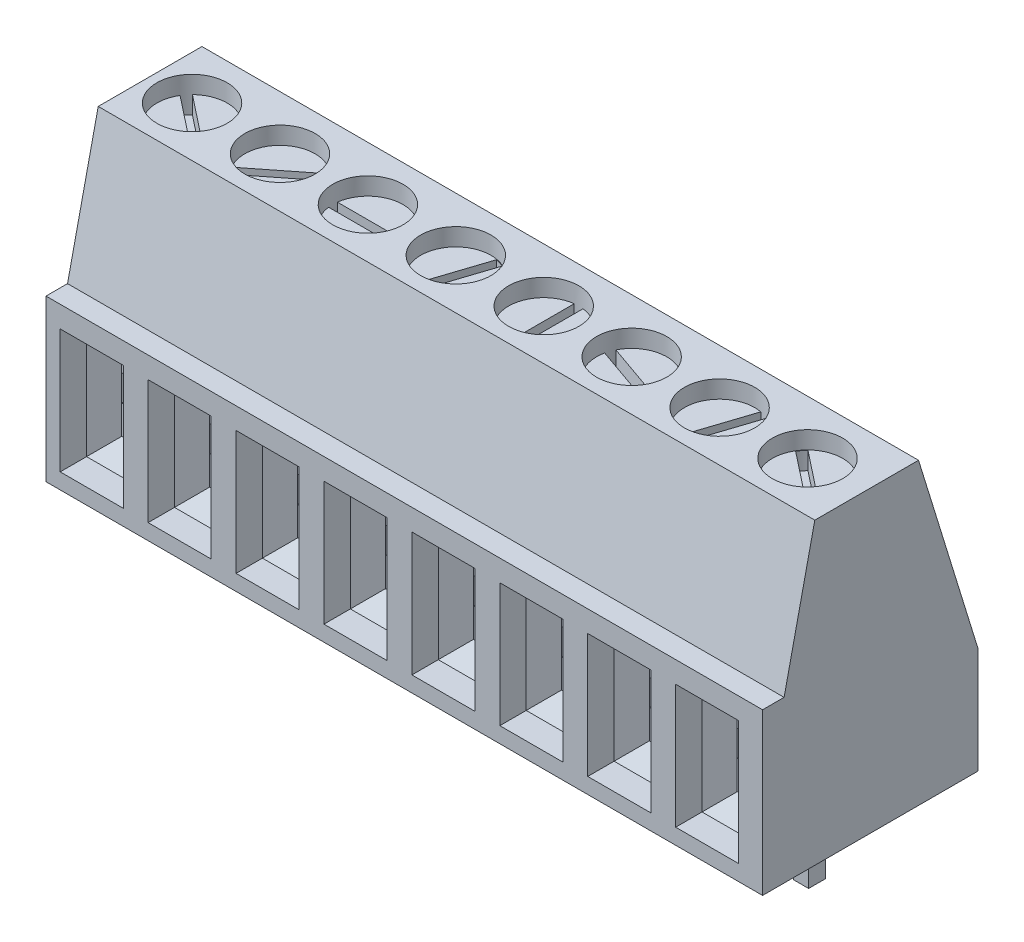
from build123d import *

# Parameters (mm, degrees)
SKETCH1_W          = 20.701
SKETCH1_H          = 6.223
EXTRUDE1_DEPTH     = 8.636
CUT_EXTRUDE1_DEPTH = 25.4
CUT_EXTRUDE2_DEPTH = 25.4
SKETCH4_R          = 1.016
CUT_EXTRUDE3_DEPTH = 0.508
CUT_EXTRUDE4_DEPTH = 0.508
SKETCH6_W          = 1.82195604
SKETCH6_H          = 3.576432228
CUT_EXTRUDE5_DEPTH = 1.27
CHAMFER1_SIZE      = 0.508
SKETCH7_W          = 0.80595604
SKETCH7_H          = 0.757943843
CUT_EXTRUDE6_DEPTH = 1.27
SKETCH8_W          = 0.433382436
SKETCH8_H          = 0.491166761
EXTRUDE2_DEPTH     = 1.905


with BuildPart() as part:
    # Sketch1 → Extrude1 (new body)
    with BuildSketch(Plane(origin=(0, 0, 0), x_dir=(1, 0, 0), z_dir=(0, 1, 0))):
        with Locations((10.3505, 3.1115)):
            Rectangle(SKETCH1_W, SKETCH1_H)
    extrude(amount=EXTRUDE1_DEPTH)

    # Sketch2 → Cut-Extrude1 (cut)
    with BuildSketch(Plane(origin=(20.701, 0, 0), x_dir=(0, 0, -1), z_dir=(1, 0, 0))):
        Polygon((-2.869110069, 4.645946632), (0.62179162, 4.645946632), (2.217632392, 11.827230107), (-2.869110069, 11.827230107), align=None)
    extrude(amount=-CUT_EXTRUDE1_DEPTH, mode=Mode.SUBTRACT)

    # Sketch3 → Cut-Extrude2 (cut)
    with BuildSketch(Plane(origin=(20.701, 0, 0), x_dir=(0, 0, -1), z_dir=(1, 0, 0))):
        Polygon((4.012953261, 10.231389335), (6.905414661, 0.855824797), (9.199435771, 0.855824797), (9.199435771, 10.231389335), align=None)
    extrude(amount=-CUT_EXTRUDE2_DEPTH, mode=Mode.SUBTRACT)

    # Sketch4 → Cut-Extrude3 (cut)
    with BuildSketch(Plane(origin=(0, 8.636, 0), x_dir=(1, 0, 0), z_dir=(0, 1, 0))):
        with Locations(Location((1.27, 2.949100672, 0), (0, 0, 270))):
            Circle(SKETCH4_R)
        with Locations(Location((3.81, 2.949100672, 0), (0, 0, 270))):
            Circle(SKETCH4_R)
        with Locations(Location((6.35, 2.949100672, 0), (0, 0, 270))):
            Circle(SKETCH4_R)
        with Locations(Location((8.89, 2.949100672, 0), (0, 0, 270))):
            Circle(SKETCH4_R)
        with Locations(Location((11.43, 2.949100672, 0), (0, 0, 270))):
            Circle(SKETCH4_R)
        with Locations(Location((13.97, 2.949100672, 0), (0, 0, 270))):
            Circle(SKETCH4_R)
        with Locations(Location((16.51, 2.949100672, 0), (0, 0, 270))):
            Circle(SKETCH4_R)
        with Locations(Location((19.05, 2.949100672, 0), (0, 0, 270))):
            Circle(SKETCH4_R)
    extrude(amount=-CUT_EXTRUDE3_DEPTH, mode=Mode.SUBTRACT)

    # Sketch5 → Cut-Extrude4 (cut)
    with BuildSketch(Plane(origin=(0, 8.128, 0), x_dir=(1, 0, 0), z_dir=(0, 1, 0))):
        with BuildLine():
            ThreePointArc((0.55685802, 3.67276117), (0.471993814, 3.577942566), (0.399647546, 3.473259623))
            Line((0.399647546, 3.473259623), (1.98314198, 2.225440174))
            ThreePointArc((1.98314198, 2.225440174), (2.068006186, 2.320258778), (2.140352454, 2.42494172))
            Line((2.140352454, 2.42494172), (0.55685802, 3.67276117))
        make_face()
        with BuildLine():
            ThreePointArc((2.939647546, 2.42494172), (3.011993814, 2.320258778), (3.09685802, 2.225440174))
            Line((3.09685802, 2.225440174), (4.680352454, 3.473259623))
            ThreePointArc((4.680352454, 3.473259623), (4.608006186, 3.577942566), (4.52314198, 3.67276117))
            Line((4.52314198, 3.67276117), (2.939647546, 2.42494172))
        make_face()
        with BuildLine():
            ThreePointArc((5.34196875, 3.076100672), (5.334, 2.949100672), (5.34196875, 2.822100672))
            Line((5.34196875, 2.822100672), (7.35803125, 2.822100672))
            ThreePointArc((7.35803125, 2.822100672), (7.364005855, 2.885475793), (7.366, 2.949100672))
            ThreePointArc((7.366, 2.949100672), (7.364005855, 3.012725551), (7.35803125, 3.076100672))
            Line((7.35803125, 3.076100672), (5.34196875, 3.076100672))
        make_face()
        with BuildLine():
            ThreePointArc((8.458529789, 2.041483422), (8.576688012, 1.994233554), (8.699870069, 1.9622946))
            Line((8.699870069, 1.9622946), (9.321470211, 3.856717921))
            ThreePointArc((9.321470211, 3.856717921), (9.203311988, 3.90396779), (9.080129931, 3.935906744))
            Line((9.080129931, 3.935906744), (8.458529789, 2.041483422))
        make_face()
        with BuildLine():
            ThreePointArc((11.557, 3.957131921), (11.43, 3.965100672), (11.303, 3.957131921))
            Line((11.303, 3.957131921), (11.303, 1.941069422))
            ThreePointArc((11.303, 1.941069422), (11.43, 1.933100672), (11.557, 1.941069422))
            Line((11.557, 1.941069422), (11.557, 3.957131921))
        make_face()
        with BuildLine():
            ThreePointArc((13.060727808, 3.402399778), (13.011197076, 3.285185412), (12.976706622, 3.162699047))
            Line((12.976706622, 3.162699047), (14.879272192, 2.495801565))
            ThreePointArc((14.879272192, 2.495801565), (14.928802924, 2.613015931), (14.963293378, 2.735502296))
            Line((14.963293378, 2.735502296), (13.060727808, 3.402399778))
        make_face()
        with BuildLine():
            ThreePointArc((16.944941036, 3.867295801), (16.826755289, 3.914461789), (16.703600756, 3.946484624))
            Line((16.703600756, 3.946484624), (16.075058964, 2.030905542))
            ThreePointArc((16.075058964, 2.030905542), (16.193244711, 1.983739555), (16.316399244, 1.95171672))
            Line((16.316399244, 1.95171672), (16.944941036, 3.867295801))
        make_face()
        with BuildLine():
            ThreePointArc((18.349819557, 3.662547267), (18.264852019, 3.567810091), (18.192609083, 3.463045721))
            Line((18.192609083, 3.463045721), (19.750180443, 2.235654077))
            ThreePointArc((19.750180443, 2.235654077), (19.835147981, 2.330391253), (19.907390917, 2.435155623))
            Line((19.907390917, 2.435155623), (18.349819557, 3.662547267))
        make_face()
    extrude(amount=-CUT_EXTRUDE4_DEPTH, mode=Mode.SUBTRACT)

    # Sketch6 → Cut-Extrude5 (cut)
    with BuildSketch(Plane.XY):
        with Locations((3.861070401, 2.24061075)):
            Rectangle(SKETCH6_W, SKETCH6_H)
        with Locations((1.321070401, 2.24061075)):
            Rectangle(SKETCH6_W, SKETCH6_H)
        with Locations((6.401070401, 2.24061075)):
            Rectangle(SKETCH6_W, SKETCH6_H)
        with Locations((8.941070401, 2.24061075)):
            Rectangle(SKETCH6_W, SKETCH6_H)
        with Locations((11.481070401, 2.24061075)):
            Rectangle(SKETCH6_W, SKETCH6_H)
        with Locations((14.021070401, 2.24061075)):
            Rectangle(SKETCH6_W, SKETCH6_H)
        with Locations((16.561070401, 2.24061075)):
            Rectangle(SKETCH6_W, SKETCH6_H)
        with Locations((19.101070401, 2.24061075)):
            Rectangle(SKETCH6_W, SKETCH6_H)
    extrude(amount=-CUT_EXTRUDE5_DEPTH, mode=Mode.SUBTRACT)

    # Chamfer1
    chamfer1_edges = [part.edges().sort_by_distance(p)[0] for p in [
        (0.410092381, 2.24061075, -1.27),
        (1.321070401, 4.028826864, -1.27),
        (2.232048421, 2.24061075, -1.27),
        (1.321070401, 0.452394636, -1.27),
        (3.861070401, 4.028826864, -1.27),
        (4.772048421, 2.24061075, -1.27),
        (3.861070401, 0.452394636, -1.27),
        (2.950092381, 2.24061075, -1.27),
        (6.401070401, 4.028826864, -1.27),
        (7.312048421, 2.24061075, -1.27),
        (6.401070401, 0.452394636, -1.27),
        (5.490092381, 2.24061075, -1.27),
        (8.941070401, 4.028826864, -1.27),
        (9.852048421, 2.24061075, -1.27),
        (8.941070401, 0.452394636, -1.27),
        (8.030092381, 2.24061075, -1.27),
        (11.481070401, 4.028826864, -1.27),
        (12.392048421, 2.24061075, -1.27),
        (11.481070401, 0.452394636, -1.27),
        (10.570092381, 2.24061075, -1.27),
        (14.021070401, 4.028826864, -1.27),
        (14.932048421, 2.24061075, -1.27),
        (14.021070401, 0.452394636, -1.27),
        (13.110092381, 2.24061075, -1.27),
        (16.561070401, 4.028826864, -1.27),
        (17.472048421, 2.24061075, -1.27),
        (16.561070401, 0.452394636, -1.27),
        (15.650092381, 2.24061075, -1.27),
        (19.101070401, 4.028826864, -1.27),
        (20.012048421, 2.24061075, -1.27),
        (19.101070401, 0.452394636, -1.27),
        (18.190092381, 2.24061075, -1.27),
    ]]
    chamfer(chamfer1_edges, length=CHAMFER1_SIZE)

    # Sketch7 → Cut-Extrude6 (cut)
    with BuildSketch(Plane.XY.offset(-1.27)):
        with Locations((1.321070401, 2.17271271)):
            Rectangle(SKETCH7_W, SKETCH7_H)
        with Locations((3.861070401, 2.17271271)):
            Rectangle(SKETCH7_W, SKETCH7_H)
        with Locations((6.401070401, 2.17271271)):
            Rectangle(SKETCH7_W, SKETCH7_H)
        with Locations((8.941070401, 2.17271271)):
            Rectangle(SKETCH7_W, SKETCH7_H)
        with Locations((11.481070401, 2.17271271)):
            Rectangle(SKETCH7_W, SKETCH7_H)
        with Locations((14.021070401, 2.17271271)):
            Rectangle(SKETCH7_W, SKETCH7_H)
        with Locations((16.561070401, 2.17271271)):
            Rectangle(SKETCH7_W, SKETCH7_H)
        with Locations((19.101070401, 2.17271271)):
            Rectangle(SKETCH7_W, SKETCH7_H)
    extrude(amount=-CUT_EXTRUDE6_DEPTH, mode=Mode.SUBTRACT)

    # Sketch8 → Extrude2 (add)
    with BuildSketch(Plane.XZ):
        with Locations((3.829530977, -2.990246105)):
            Rectangle(SKETCH8_W, SKETCH8_H)
        with Locations((1.289530977, -2.990246105)):
            Rectangle(SKETCH8_W, SKETCH8_H)
        with Locations((6.369530977, -2.990246105)):
            Rectangle(SKETCH8_W, SKETCH8_H)
        with Locations((8.909530977, -2.990246105)):
            Rectangle(SKETCH8_W, SKETCH8_H)
        with Locations((11.449530977, -2.990246105)):
            Rectangle(SKETCH8_W, SKETCH8_H)
        with Locations((13.989530977, -2.990246105)):
            Rectangle(SKETCH8_W, SKETCH8_H)
        with Locations((16.529530977, -2.990246105)):
            Rectangle(SKETCH8_W, SKETCH8_H)
        with Locations((19.069530977, -2.990246105)):
            Rectangle(SKETCH8_W, SKETCH8_H)
    extrude(amount=EXTRUDE2_DEPTH)


solid = part.part
